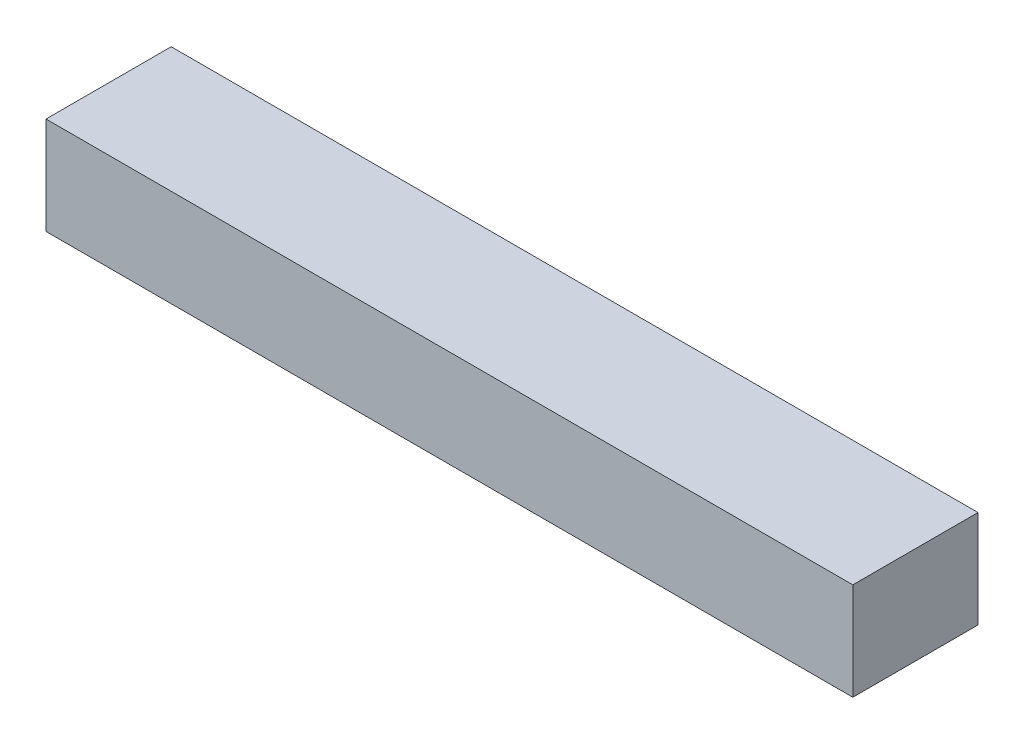
from build123d import *

# Parameters (mm, degrees)
SKETCH_1_W      = 116
SKETCH_1_H      = 14
EXTRUDE_1_DEPTH = 18


with BuildPart() as part:
    # 草图1 → 凸台-拉伸1 (new body)
    with BuildSketch(Plane.XY):
        Rectangle(SKETCH_1_W, SKETCH_1_H)
    extrude(amount=-EXTRUDE_1_DEPTH)


solid = part.part
